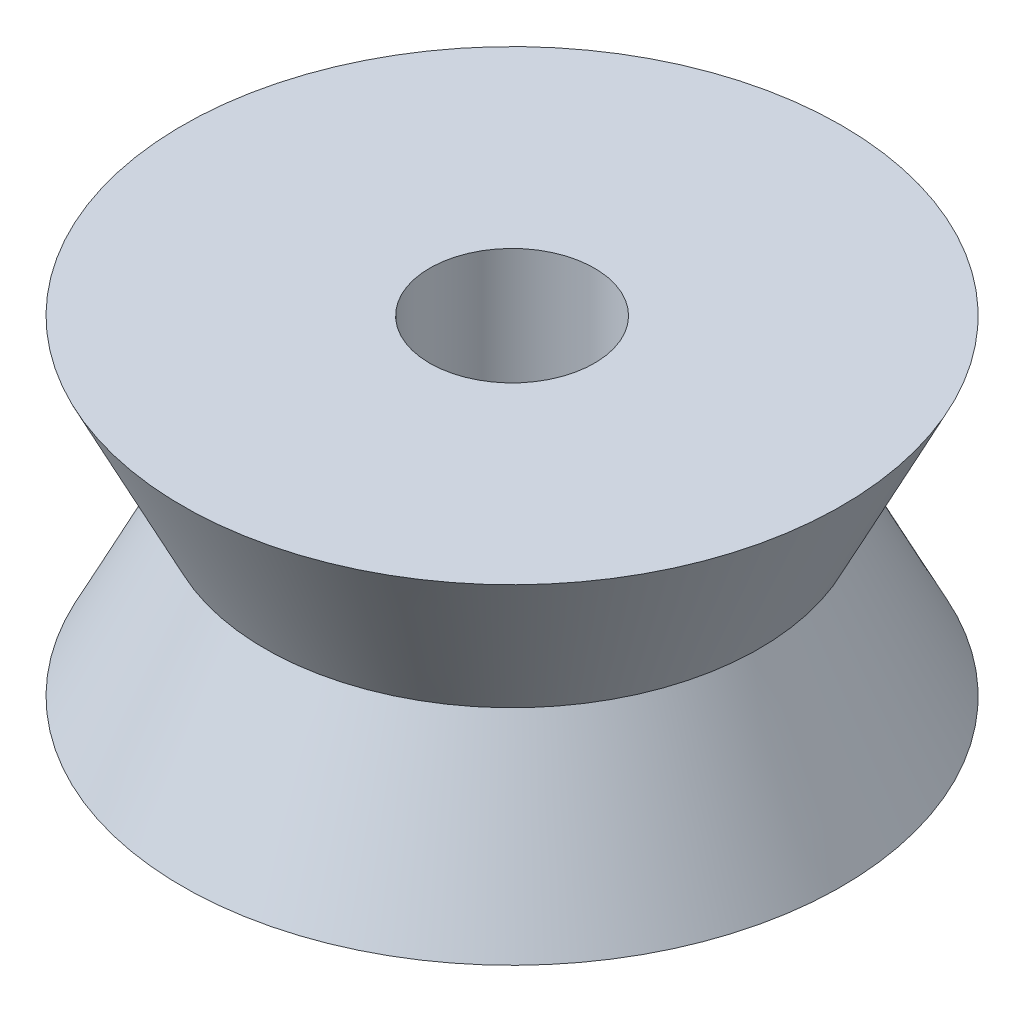
from build123d import *

# Parameters (mm, degrees)
SKETCH2_R          = 5
CUT_EXTRUDE1_DEPTH = 35.641016151


with BuildPart() as part:
    # Sketch1 → Revolve1 (revolve)
    with BuildSketch(Plane.XY, mode=Mode.PRIVATE) as revolve1_sk:
        Polygon((-20, 20), (-15, 10), (-20, 0), (0, 0), (0, 20), align=None)
    revolve(revolve1_sk.sketch.rotate(Axis((0, 0, 0), (0, 1, 0)), 270), axis=Axis((0, 0, 0), (0, 1, 0)))

    # Sketch2 → Cut-Extrude1 (cut, through all)
    with BuildSketch(Plane(origin=(0, 20, 0), x_dir=(1, 0, 0), z_dir=(0, 1, 0))):
        with Locations(Location((0, 0, 0), (0, 0, 270))):
            Circle(SKETCH2_R)
    extrude(amount=-CUT_EXTRUDE1_DEPTH, mode=Mode.SUBTRACT)


solid = part.part
